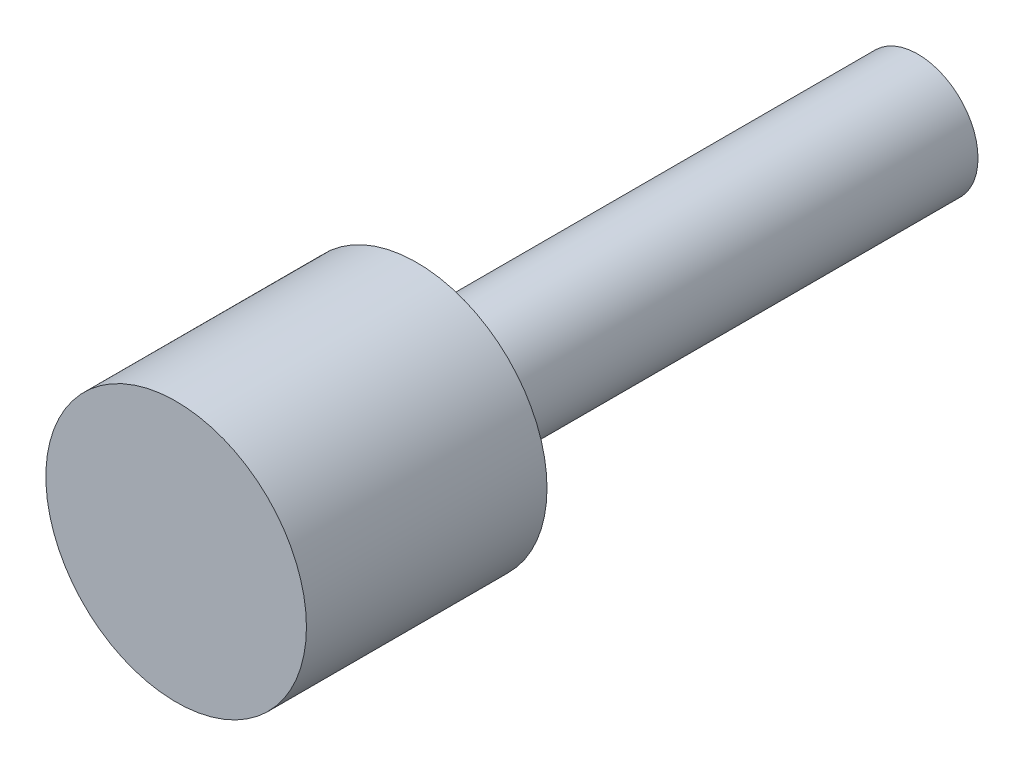
from build123d import *

# Parameters (mm, degrees)
SKETCH_1_R      = 3
EXTRUDE_1_DEPTH = 12.5
SKETCH_2_R      = 6.5
EXTRUDE_2_DEPTH = 12


with BuildPart() as part:
    # 草图1 → 凸台-拉伸1 (new, symmetric)
    with BuildSketch(Plane.XY):
        Circle(SKETCH_1_R)
    extrude(amount=EXTRUDE_1_DEPTH, both=True)

    # 草图2 → 凸台-拉伸2 (add)
    with BuildSketch(Plane.XY.offset(12.5)):
        Circle(SKETCH_2_R)
    extrude(amount=EXTRUDE_2_DEPTH)


solid = part.part
